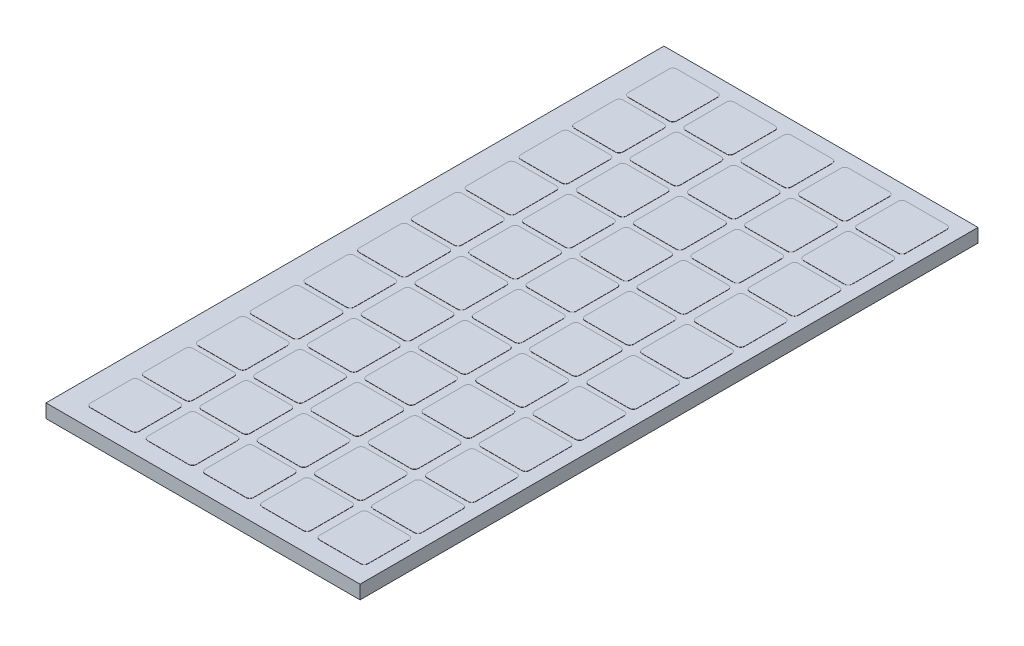
from build123d import *

# Parameters (mm, degrees)
SKETCH_5_W          = 806
SKETCH_5_H          = 1586
EXTRUDE_1_DEPTH     = 35
EXTRUDE_2_DEPTH     = 0.5
EXTRUDE_2_2_DEPTH   = 0.5
EXTRUDE_2_3_DEPTH   = 0.5
EXTRUDE_2_4_DEPTH   = 0.5
EXTRUDE_2_5_DEPTH   = 0.5
EXTRUDE_2_6_DEPTH   = 0.5
EXTRUDE_2_7_DEPTH   = 0.5
EXTRUDE_2_8_DEPTH   = 0.5
EXTRUDE_2_9_DEPTH   = 0.5
EXTRUDE_2_10_DEPTH  = 0.5
EXTRUDE_2_11_DEPTH  = 0.5
EXTRUDE_2_12_DEPTH  = 0.5
EXTRUDE_2_13_DEPTH  = 0.5
EXTRUDE_2_14_DEPTH  = 0.5
EXTRUDE_2_15_DEPTH  = 0.5
EXTRUDE_2_16_DEPTH  = 0.5
EXTRUDE_2_17_DEPTH  = 0.5
EXTRUDE_2_18_DEPTH  = 0.5
EXTRUDE_2_19_DEPTH  = 0.5
EXTRUDE_2_20_DEPTH  = 0.5
EXTRUDE_2_21_DEPTH  = 0.5
EXTRUDE_2_22_DEPTH  = 0.5
EXTRUDE_2_23_DEPTH  = 0.5
EXTRUDE_2_24_DEPTH  = 0.5
EXTRUDE_2_25_DEPTH  = 0.5
EXTRUDE_2_26_DEPTH  = 0.5
EXTRUDE_2_27_DEPTH  = 0.5
EXTRUDE_2_28_DEPTH  = 0.5
EXTRUDE_2_29_DEPTH  = 0.5
EXTRUDE_2_30_DEPTH  = 0.5
EXTRUDE_2_31_DEPTH  = 0.5
EXTRUDE_2_32_DEPTH  = 0.5
EXTRUDE_2_33_DEPTH  = 0.5
EXTRUDE_2_34_DEPTH  = 0.5
EXTRUDE_2_35_DEPTH  = 0.5
EXTRUDE_2_36_DEPTH  = 0.5
EXTRUDE_2_37_DEPTH  = 0.5
EXTRUDE_2_38_DEPTH  = 0.5
EXTRUDE_2_39_DEPTH  = 0.5
EXTRUDE_2_40_DEPTH  = 0.5
EXTRUDE_2_41_DEPTH  = 0.5
EXTRUDE_2_42_DEPTH  = 0.5
EXTRUDE_2_43_DEPTH  = 0.5
EXTRUDE_2_44_DEPTH  = 0.5
EXTRUDE_2_45_DEPTH  = 0.5
EXTRUDE_2_46_DEPTH  = 0.5
EXTRUDE_2_47_DEPTH  = 0.5
EXTRUDE_2_48_DEPTH  = 0.5
EXTRUDE_2_49_DEPTH  = 0.5
EXTRUDE_2_50_DEPTH  = 0.5
EXTRUDE_2_51_DEPTH  = 0.5
EXTRUDE_2_52_DEPTH  = 0.5
EXTRUDE_2_53_DEPTH  = 0.5
EXTRUDE_2_54_DEPTH  = 0.5
EXTRUDE_2_55_DEPTH  = 0.5
SKETCH_8_W          = 30
SKETCH_8_H          = 30
EXTRUDE_3_DEPTH     = 30
SKETCH_9_R          = 12.5
CUT_EXTRUDE_1_DEPTH = 1641.542669363


with BuildPart() as part:
    # Эскиз5 → Бобышка-Вытянуть1 (new body)
    with BuildSketch(Plane(origin=(0, 0, 0), x_dir=(1, 0, 0), z_dir=(0, 1, 0))):
        with Locations((403, 793)):
            Rectangle(SKETCH_5_W, SKETCH_5_H)
    extrude(amount=EXTRUDE_1_DEPTH)

    # Эскиз8 → Бобышка-Вытянуть3 (add)
    with BuildSketch(Plane.XZ):
        with Locations((403, -793)):
            Rectangle(SKETCH_8_W, SKETCH_8_H)
    extrude(amount=EXTRUDE_3_DEPTH)

    # Эскиз9 → Вырез-Вытянуть1 (cut, through all)
    with BuildSketch(Plane.ZY.offset(-388)):
        with Locations((-793, -15)):
            Circle(SKETCH_9_R)
    extrude(amount=-CUT_EXTRUDE_1_DEPTH, mode=Mode.SUBTRACT)


with BuildPart() as body_2:
    # Эскиз7 → Бобышка-Вытянуть2 (new body)
    with BuildSketch(Plane(origin=(0, 35, 0), x_dir=(1, 0, 0), z_dir=(0, 1, 0))):
        with BuildLine():
            Line((761, 1551), (656, 1551))
            ThreePointArc((656, 1551), (648.928932188, 1548.071067812), (646, 1541))
            Line((646, 1541), (646, 1436))
            ThreePointArc((646, 1436), (648.928932188, 1428.928932188), (656, 1426))
            Line((656, 1426), (761, 1426))
            ThreePointArc((761, 1426), (768.071067812, 1428.928932188), (771, 1436))
            Line((771, 1436), (771, 1541))
            ThreePointArc((771, 1541), (768.071067812, 1548.071067812), (761, 1551))
        make_face()
    extrude(amount=EXTRUDE_2_DEPTH)


with BuildPart() as body_3:
    # Эскиз7 → Extrude 2 2 (new body)
    with BuildSketch(Plane(origin=(0, 35, 0), x_dir=(1, 0, 0), z_dir=(0, 1, 0))):
        with BuildLine():
            Line((771, 1403), (771, 1298))
            ThreePointArc((771, 1298), (768.071067812, 1290.928932188), (761, 1288))
            Line((761, 1288), (656, 1288))
            ThreePointArc((656, 1288), (648.928932188, 1290.928932188), (646, 1298))
            Line((646, 1298), (646, 1403))
            ThreePointArc((646, 1403), (648.928932188, 1410.071067812), (656, 1413))
            Line((656, 1413), (761, 1413))
            ThreePointArc((761, 1413), (768.071067812, 1410.071067812), (771, 1403))
        make_face()
    extrude(amount=EXTRUDE_2_2_DEPTH)


with BuildPart() as body_4:
    # Эскиз7 → Extrude 2 3 (new body)
    with BuildSketch(Plane(origin=(0, 35, 0), x_dir=(1, 0, 0), z_dir=(0, 1, 0))):
        with BuildLine():
            Line((771, 1265), (771, 1160))
            ThreePointArc((771, 1160), (768.071067812, 1152.928932188), (761, 1150))
            Line((761, 1150), (656, 1150))
            ThreePointArc((656, 1150), (648.928932188, 1152.928932188), (646, 1160))
            Line((646, 1160), (646, 1265))
            ThreePointArc((646, 1265), (648.928932188, 1272.071067812), (656, 1275))
            Line((656, 1275), (761, 1275))
            ThreePointArc((761, 1275), (768.071067812, 1272.071067812), (771, 1265))
        make_face()
    extrude(amount=EXTRUDE_2_3_DEPTH)


with BuildPart() as body_5:
    # Эскиз7 → Extrude 2 4 (new body)
    with BuildSketch(Plane(origin=(0, 35, 0), x_dir=(1, 0, 0), z_dir=(0, 1, 0))):
        with BuildLine():
            Line((771, 1127), (771, 1022))
            ThreePointArc((771, 1022), (768.071067812, 1014.928932188), (761, 1012))
            Line((761, 1012), (656, 1012))
            ThreePointArc((656, 1012), (648.928932188, 1014.928932188), (646, 1022))
            Line((646, 1022), (646, 1127))
            ThreePointArc((646, 1127), (648.928932188, 1134.071067812), (656, 1137))
            Line((656, 1137), (761, 1137))
            ThreePointArc((761, 1137), (768.071067812, 1134.071067812), (771, 1127))
        make_face()
    extrude(amount=EXTRUDE_2_4_DEPTH)


with BuildPart() as body_6:
    # Эскиз7 → Extrude 2 5 (new body)
    with BuildSketch(Plane(origin=(0, 35, 0), x_dir=(1, 0, 0), z_dir=(0, 1, 0))):
        with BuildLine():
            Line((771, 989), (771, 884))
            ThreePointArc((771, 884), (768.071067812, 876.928932188), (761, 874))
            Line((761, 874), (656, 874))
            ThreePointArc((656, 874), (648.928932188, 876.928932188), (646, 884))
            Line((646, 884), (646, 989))
            ThreePointArc((646, 989), (648.928932188, 996.071067812), (656, 999))
            Line((656, 999), (761, 999))
            ThreePointArc((761, 999), (768.071067812, 996.071067812), (771, 989))
        make_face()
    extrude(amount=EXTRUDE_2_5_DEPTH)


with BuildPart() as body_7:
    # Эскиз7 → Extrude 2 6 (new body)
    with BuildSketch(Plane(origin=(0, 35, 0), x_dir=(1, 0, 0), z_dir=(0, 1, 0))):
        with BuildLine():
            Line((771, 851), (771, 746))
            ThreePointArc((771, 746), (768.071067812, 738.928932188), (761, 736))
            Line((761, 736), (656, 736))
            ThreePointArc((656, 736), (648.928932188, 738.928932188), (646, 746))
            Line((646, 746), (646, 851))
            ThreePointArc((646, 851), (648.928932188, 858.071067812), (656, 861))
            Line((656, 861), (761, 861))
            ThreePointArc((761, 861), (768.071067812, 858.071067812), (771, 851))
        make_face()
    extrude(amount=EXTRUDE_2_6_DEPTH)


with BuildPart() as body_8:
    # Эскиз7 → Extrude 2 7 (new body)
    with BuildSketch(Plane(origin=(0, 35, 0), x_dir=(1, 0, 0), z_dir=(0, 1, 0))):
        with BuildLine():
            Line((771, 713), (771, 608))
            ThreePointArc((771, 608), (768.071067812, 600.928932188), (761, 598))
            Line((761, 598), (656, 598))
            ThreePointArc((656, 598), (648.928932188, 600.928932188), (646, 608))
            Line((646, 608), (646, 713))
            ThreePointArc((646, 713), (648.928932188, 720.071067812), (656, 723))
            Line((656, 723), (761, 723))
            ThreePointArc((761, 723), (768.071067812, 720.071067812), (771, 713))
        make_face()
    extrude(amount=EXTRUDE_2_7_DEPTH)


with BuildPart() as body_9:
    # Эскиз7 → Extrude 2 8 (new body)
    with BuildSketch(Plane(origin=(0, 35, 0), x_dir=(1, 0, 0), z_dir=(0, 1, 0))):
        with BuildLine():
            Line((771, 575), (771, 470))
            ThreePointArc((771, 470), (768.071067812, 462.928932188), (761, 460))
            Line((761, 460), (656, 460))
            ThreePointArc((656, 460), (648.928932188, 462.928932188), (646, 470))
            Line((646, 470), (646, 575))
            ThreePointArc((646, 575), (648.928932188, 582.071067812), (656, 585))
            Line((656, 585), (761, 585))
            ThreePointArc((761, 585), (768.071067812, 582.071067812), (771, 575))
        make_face()
    extrude(amount=EXTRUDE_2_8_DEPTH)


with BuildPart() as body_10:
    # Эскиз7 → Extrude 2 9 (new body)
    with BuildSketch(Plane(origin=(0, 35, 0), x_dir=(1, 0, 0), z_dir=(0, 1, 0))):
        with BuildLine():
            Line((771, 437), (771, 332))
            ThreePointArc((771, 332), (768.071067812, 324.928932188), (761, 322))
            Line((761, 322), (656, 322))
            ThreePointArc((656, 322), (648.928932188, 324.928932188), (646, 332))
            Line((646, 332), (646, 437))
            ThreePointArc((646, 437), (648.928932188, 444.071067812), (656, 447))
            Line((656, 447), (761, 447))
            ThreePointArc((761, 447), (768.071067812, 444.071067812), (771, 437))
        make_face()
    extrude(amount=EXTRUDE_2_9_DEPTH)


with BuildPart() as body_11:
    # Эскиз7 → Extrude 2 10 (new body)
    with BuildSketch(Plane(origin=(0, 35, 0), x_dir=(1, 0, 0), z_dir=(0, 1, 0))):
        with BuildLine():
            Line((771, 299), (771, 194))
            ThreePointArc((771, 194), (768.071067812, 186.928932188), (761, 184))
            Line((761, 184), (656, 184))
            ThreePointArc((656, 184), (648.928932188, 186.928932188), (646, 194))
            Line((646, 194), (646, 299))
            ThreePointArc((646, 299), (648.928932188, 306.071067812), (656, 309))
            Line((656, 309), (761, 309))
            ThreePointArc((761, 309), (768.071067812, 306.071067812), (771, 299))
        make_face()
    extrude(amount=EXTRUDE_2_10_DEPTH)


with BuildPart() as body_12:
    # Эскиз7 → Extrude 2 11 (new body)
    with BuildSketch(Plane(origin=(0, 35, 0), x_dir=(1, 0, 0), z_dir=(0, 1, 0))):
        with BuildLine():
            Line((771, 161), (771, 56))
            ThreePointArc((771, 56), (768.071067812, 48.928932188), (761, 46))
            Line((761, 46), (656, 46))
            ThreePointArc((656, 46), (648.928932188, 48.928932188), (646, 56))
            Line((646, 56), (646, 161))
            ThreePointArc((646, 161), (648.928932188, 168.071067812), (656, 171))
            Line((656, 171), (761, 171))
            ThreePointArc((761, 171), (768.071067812, 168.071067812), (771, 161))
        make_face()
    extrude(amount=EXTRUDE_2_11_DEPTH)


with BuildPart() as body_13:
    # Эскиз7 → Extrude 2 12 (new body)
    with BuildSketch(Plane(origin=(0, 35, 0), x_dir=(1, 0, 0), z_dir=(0, 1, 0))):
        with BuildLine():
            Line((624, 1541), (624, 1436))
            ThreePointArc((624, 1436), (621.071067812, 1428.928932188), (614, 1426))
            Line((614, 1426), (509, 1426))
            ThreePointArc((509, 1426), (501.928932188, 1428.928932188), (499, 1436))
            Line((499, 1436), (499, 1541))
            ThreePointArc((499, 1541), (501.928932188, 1548.071067812), (509, 1551))
            Line((509, 1551), (614, 1551))
            ThreePointArc((614, 1551), (621.071067812, 1548.071067812), (624, 1541))
        make_face()
    extrude(amount=EXTRUDE_2_12_DEPTH)


with BuildPart() as body_14:
    # Эскиз7 → Extrude 2 13 (new body)
    with BuildSketch(Plane(origin=(0, 35, 0), x_dir=(1, 0, 0), z_dir=(0, 1, 0))):
        with BuildLine():
            Line((624, 1265), (624, 1160))
            ThreePointArc((624, 1160), (621.071067812, 1152.928932188), (614, 1150))
            Line((614, 1150), (509, 1150))
            ThreePointArc((509, 1150), (501.928932188, 1152.928932188), (499, 1160))
            Line((499, 1160), (499, 1265))
            ThreePointArc((499, 1265), (501.928932188, 1272.071067812), (509, 1275))
            Line((509, 1275), (614, 1275))
            ThreePointArc((614, 1275), (621.071067812, 1272.071067812), (624, 1265))
        make_face()
    extrude(amount=EXTRUDE_2_13_DEPTH)


with BuildPart() as body_15:
    # Эскиз7 → Extrude 2 14 (new body)
    with BuildSketch(Plane(origin=(0, 35, 0), x_dir=(1, 0, 0), z_dir=(0, 1, 0))):
        with BuildLine():
            Line((624, 1403), (624, 1298))
            ThreePointArc((624, 1298), (621.071067812, 1290.928932188), (614, 1288))
            Line((614, 1288), (509, 1288))
            ThreePointArc((509, 1288), (501.928932188, 1290.928932188), (499, 1298))
            Line((499, 1298), (499, 1403))
            ThreePointArc((499, 1403), (501.928932188, 1410.071067812), (509, 1413))
            Line((509, 1413), (614, 1413))
            ThreePointArc((614, 1413), (621.071067812, 1410.071067812), (624, 1403))
        make_face()
    extrude(amount=EXTRUDE_2_14_DEPTH)


with BuildPart() as body_16:
    # Эскиз7 → Extrude 2 15 (new body)
    with BuildSketch(Plane(origin=(0, 35, 0), x_dir=(1, 0, 0), z_dir=(0, 1, 0))):
        with BuildLine():
            Line((624, 989), (624, 884))
            ThreePointArc((624, 884), (621.071067812, 876.928932188), (614, 874))
            Line((614, 874), (509, 874))
            ThreePointArc((509, 874), (501.928932188, 876.928932188), (499, 884))
            Line((499, 884), (499, 989))
            ThreePointArc((499, 989), (501.928932188, 996.071067812), (509, 999))
            Line((509, 999), (614, 999))
            ThreePointArc((614, 999), (621.071067812, 996.071067812), (624, 989))
        make_face()
    extrude(amount=EXTRUDE_2_15_DEPTH)


with BuildPart() as body_17:
    # Эскиз7 → Extrude 2 16 (new body)
    with BuildSketch(Plane(origin=(0, 35, 0), x_dir=(1, 0, 0), z_dir=(0, 1, 0))):
        with BuildLine():
            Line((624, 1127), (624, 1022))
            ThreePointArc((624, 1022), (621.071067812, 1014.928932188), (614, 1012))
            Line((614, 1012), (509, 1012))
            ThreePointArc((509, 1012), (501.928932188, 1014.928932188), (499, 1022))
            Line((499, 1022), (499, 1127))
            ThreePointArc((499, 1127), (501.928932188, 1134.071067812), (509, 1137))
            Line((509, 1137), (614, 1137))
            ThreePointArc((614, 1137), (621.071067812, 1134.071067812), (624, 1127))
        make_face()
    extrude(amount=EXTRUDE_2_16_DEPTH)


with BuildPart() as body_18:
    # Эскиз7 → Extrude 2 17 (new body)
    with BuildSketch(Plane(origin=(0, 35, 0), x_dir=(1, 0, 0), z_dir=(0, 1, 0))):
        with BuildLine():
            Line((624, 851), (624, 746))
            ThreePointArc((624, 746), (621.071067812, 738.928932188), (614, 736))
            Line((614, 736), (509, 736))
            ThreePointArc((509, 736), (501.928932188, 738.928932188), (499, 746))
            Line((499, 746), (499, 851))
            ThreePointArc((499, 851), (501.928932188, 858.071067812), (509, 861))
            Line((509, 861), (614, 861))
            ThreePointArc((614, 861), (621.071067812, 858.071067812), (624, 851))
        make_face()
    extrude(amount=EXTRUDE_2_17_DEPTH)


with BuildPart() as body_19:
    # Эскиз7 → Extrude 2 18 (new body)
    with BuildSketch(Plane(origin=(0, 35, 0), x_dir=(1, 0, 0), z_dir=(0, 1, 0))):
        with BuildLine():
            Line((624, 713), (624, 608))
            ThreePointArc((624, 608), (621.071067812, 600.928932188), (614, 598))
            Line((614, 598), (509, 598))
            ThreePointArc((509, 598), (501.928932188, 600.928932188), (499, 608))
            Line((499, 608), (499, 713))
            ThreePointArc((499, 713), (501.928932188, 720.071067812), (509, 723))
            Line((509, 723), (614, 723))
            ThreePointArc((614, 723), (621.071067812, 720.071067812), (624, 713))
        make_face()
    extrude(amount=EXTRUDE_2_18_DEPTH)


with BuildPart() as body_20:
    # Эскиз7 → Extrude 2 19 (new body)
    with BuildSketch(Plane(origin=(0, 35, 0), x_dir=(1, 0, 0), z_dir=(0, 1, 0))):
        with BuildLine():
            Line((624, 575), (624, 470))
            ThreePointArc((624, 470), (621.071067812, 462.928932188), (614, 460))
            Line((614, 460), (509, 460))
            ThreePointArc((509, 460), (501.928932188, 462.928932188), (499, 470))
            Line((499, 470), (499, 575))
            ThreePointArc((499, 575), (501.928932188, 582.071067812), (509, 585))
            Line((509, 585), (614, 585))
            ThreePointArc((614, 585), (621.071067812, 582.071067812), (624, 575))
        make_face()
    extrude(amount=EXTRUDE_2_19_DEPTH)


with BuildPart() as body_21:
    # Эскиз7 → Extrude 2 20 (new body)
    with BuildSketch(Plane(origin=(0, 35, 0), x_dir=(1, 0, 0), z_dir=(0, 1, 0))):
        with BuildLine():
            Line((624, 437), (624, 332))
            ThreePointArc((624, 332), (621.071067812, 324.928932188), (614, 322))
            Line((614, 322), (509, 322))
            ThreePointArc((509, 322), (501.928932188, 324.928932188), (499, 332))
            Line((499, 332), (499, 437))
            ThreePointArc((499, 437), (501.928932188, 444.071067812), (509, 447))
            Line((509, 447), (614, 447))
            ThreePointArc((614, 447), (621.071067812, 444.071067812), (624, 437))
        make_face()
    extrude(amount=EXTRUDE_2_20_DEPTH)


with BuildPart() as body_22:
    # Эскиз7 → Extrude 2 21 (new body)
    with BuildSketch(Plane(origin=(0, 35, 0), x_dir=(1, 0, 0), z_dir=(0, 1, 0))):
        with BuildLine():
            Line((624, 299), (624, 194))
            ThreePointArc((624, 194), (621.071067812, 186.928932188), (614, 184))
            Line((614, 184), (509, 184))
            ThreePointArc((509, 184), (501.928932188, 186.928932188), (499, 194))
            Line((499, 194), (499, 299))
            ThreePointArc((499, 299), (501.928932188, 306.071067812), (509, 309))
            Line((509, 309), (614, 309))
            ThreePointArc((614, 309), (621.071067812, 306.071067812), (624, 299))
        make_face()
    extrude(amount=EXTRUDE_2_21_DEPTH)


with BuildPart() as body_23:
    # Эскиз7 → Extrude 2 22 (new body)
    with BuildSketch(Plane(origin=(0, 35, 0), x_dir=(1, 0, 0), z_dir=(0, 1, 0))):
        with BuildLine():
            Line((624, 161), (624, 56))
            ThreePointArc((624, 56), (621.071067812, 48.928932188), (614, 46))
            Line((614, 46), (509, 46))
            ThreePointArc((509, 46), (501.928932188, 48.928932188), (499, 56))
            Line((499, 56), (499, 161))
            ThreePointArc((499, 161), (501.928932188, 168.071067812), (509, 171))
            Line((509, 171), (614, 171))
            ThreePointArc((614, 171), (621.071067812, 168.071067812), (624, 161))
        make_face()
    extrude(amount=EXTRUDE_2_22_DEPTH)


with BuildPart() as body_24:
    # Эскиз7 → Extrude 2 23 (new body)
    with BuildSketch(Plane(origin=(0, 35, 0), x_dir=(1, 0, 0), z_dir=(0, 1, 0))):
        with BuildLine():
            Line((477, 1541), (477, 1436))
            ThreePointArc((477, 1436), (474.071067812, 1428.928932188), (467, 1426))
            Line((467, 1426), (362, 1426))
            ThreePointArc((362, 1426), (354.928932188, 1428.928932188), (352, 1436))
            Line((352, 1436), (352, 1541))
            ThreePointArc((352, 1541), (354.928932188, 1548.071067812), (362, 1551))
            Line((362, 1551), (467, 1551))
            ThreePointArc((467, 1551), (474.071067812, 1548.071067812), (477, 1541))
        make_face()
    extrude(amount=EXTRUDE_2_23_DEPTH)


with BuildPart() as body_25:
    # Эскиз7 → Extrude 2 24 (new body)
    with BuildSketch(Plane(origin=(0, 35, 0), x_dir=(1, 0, 0), z_dir=(0, 1, 0))):
        with BuildLine():
            Line((477, 1265), (477, 1160))
            ThreePointArc((477, 1160), (474.071067812, 1152.928932188), (467, 1150))
            Line((467, 1150), (362, 1150))
            ThreePointArc((362, 1150), (354.928932188, 1152.928932188), (352, 1160))
            Line((352, 1160), (352, 1265))
            ThreePointArc((352, 1265), (354.928932188, 1272.071067812), (362, 1275))
            Line((362, 1275), (467, 1275))
            ThreePointArc((467, 1275), (474.071067812, 1272.071067812), (477, 1265))
        make_face()
    extrude(amount=EXTRUDE_2_24_DEPTH)


with BuildPart() as body_26:
    # Эскиз7 → Extrude 2 25 (new body)
    with BuildSketch(Plane(origin=(0, 35, 0), x_dir=(1, 0, 0), z_dir=(0, 1, 0))):
        with BuildLine():
            Line((477, 1403), (477, 1298))
            ThreePointArc((477, 1298), (474.071067812, 1290.928932188), (467, 1288))
            Line((467, 1288), (362, 1288))
            ThreePointArc((362, 1288), (354.928932188, 1290.928932188), (352, 1298))
            Line((352, 1298), (352, 1403))
            ThreePointArc((352, 1403), (354.928932188, 1410.071067812), (362, 1413))
            Line((362, 1413), (467, 1413))
            ThreePointArc((467, 1413), (474.071067812, 1410.071067812), (477, 1403))
        make_face()
    extrude(amount=EXTRUDE_2_25_DEPTH)


with BuildPart() as body_27:
    # Эскиз7 → Extrude 2 26 (new body)
    with BuildSketch(Plane(origin=(0, 35, 0), x_dir=(1, 0, 0), z_dir=(0, 1, 0))):
        with BuildLine():
            Line((477, 989), (477, 884))
            ThreePointArc((477, 884), (474.071067812, 876.928932188), (467, 874))
            Line((467, 874), (362, 874))
            ThreePointArc((362, 874), (354.928932188, 876.928932188), (352, 884))
            Line((352, 884), (352, 989))
            ThreePointArc((352, 989), (354.928932188, 996.071067812), (362, 999))
            Line((362, 999), (467, 999))
            ThreePointArc((467, 999), (474.071067812, 996.071067812), (477, 989))
        make_face()
    extrude(amount=EXTRUDE_2_26_DEPTH)


with BuildPart() as body_28:
    # Эскиз7 → Extrude 2 27 (new body)
    with BuildSketch(Plane(origin=(0, 35, 0), x_dir=(1, 0, 0), z_dir=(0, 1, 0))):
        with BuildLine():
            Line((477, 1127), (477, 1022))
            ThreePointArc((477, 1022), (474.071067812, 1014.928932188), (467, 1012))
            Line((467, 1012), (362, 1012))
            ThreePointArc((362, 1012), (354.928932188, 1014.928932188), (352, 1022))
            Line((352, 1022), (352, 1127))
            ThreePointArc((352, 1127), (354.928932188, 1134.071067812), (362, 1137))
            Line((362, 1137), (467, 1137))
            ThreePointArc((467, 1137), (474.071067812, 1134.071067812), (477, 1127))
        make_face()
    extrude(amount=EXTRUDE_2_27_DEPTH)


with BuildPart() as body_29:
    # Эскиз7 → Extrude 2 28 (new body)
    with BuildSketch(Plane(origin=(0, 35, 0), x_dir=(1, 0, 0), z_dir=(0, 1, 0))):
        with BuildLine():
            Line((477, 851), (477, 746))
            ThreePointArc((477, 746), (474.071067812, 738.928932188), (467, 736))
            Line((467, 736), (362, 736))
            ThreePointArc((362, 736), (354.928932188, 738.928932188), (352, 746))
            Line((352, 746), (352, 851))
            ThreePointArc((352, 851), (354.928932188, 858.071067812), (362, 861))
            Line((362, 861), (467, 861))
            ThreePointArc((467, 861), (474.071067812, 858.071067812), (477, 851))
        make_face()
    extrude(amount=EXTRUDE_2_28_DEPTH)


with BuildPart() as body_30:
    # Эскиз7 → Extrude 2 29 (new body)
    with BuildSketch(Plane(origin=(0, 35, 0), x_dir=(1, 0, 0), z_dir=(0, 1, 0))):
        with BuildLine():
            Line((477, 713), (477, 608))
            ThreePointArc((477, 608), (474.071067812, 600.928932188), (467, 598))
            Line((467, 598), (362, 598))
            ThreePointArc((362, 598), (354.928932188, 600.928932188), (352, 608))
            Line((352, 608), (352, 713))
            ThreePointArc((352, 713), (354.928932188, 720.071067812), (362, 723))
            Line((362, 723), (467, 723))
            ThreePointArc((467, 723), (474.071067812, 720.071067812), (477, 713))
        make_face()
    extrude(amount=EXTRUDE_2_29_DEPTH)


with BuildPart() as body_31:
    # Эскиз7 → Extrude 2 30 (new body)
    with BuildSketch(Plane(origin=(0, 35, 0), x_dir=(1, 0, 0), z_dir=(0, 1, 0))):
        with BuildLine():
            Line((477, 575), (477, 470))
            ThreePointArc((477, 470), (474.071067812, 462.928932188), (467, 460))
            Line((467, 460), (362, 460))
            ThreePointArc((362, 460), (354.928932188, 462.928932188), (352, 470))
            Line((352, 470), (352, 575))
            ThreePointArc((352, 575), (354.928932188, 582.071067812), (362, 585))
            Line((362, 585), (467, 585))
            ThreePointArc((467, 585), (474.071067812, 582.071067812), (477, 575))
        make_face()
    extrude(amount=EXTRUDE_2_30_DEPTH)


with BuildPart() as body_32:
    # Эскиз7 → Extrude 2 31 (new body)
    with BuildSketch(Plane(origin=(0, 35, 0), x_dir=(1, 0, 0), z_dir=(0, 1, 0))):
        with BuildLine():
            Line((477, 437), (477, 332))
            ThreePointArc((477, 332), (474.071067812, 324.928932188), (467, 322))
            Line((467, 322), (362, 322))
            ThreePointArc((362, 322), (354.928932188, 324.928932188), (352, 332))
            Line((352, 332), (352, 437))
            ThreePointArc((352, 437), (354.928932188, 444.071067812), (362, 447))
            Line((362, 447), (467, 447))
            ThreePointArc((467, 447), (474.071067812, 444.071067812), (477, 437))
        make_face()
    extrude(amount=EXTRUDE_2_31_DEPTH)


with BuildPart() as body_33:
    # Эскиз7 → Extrude 2 32 (new body)
    with BuildSketch(Plane(origin=(0, 35, 0), x_dir=(1, 0, 0), z_dir=(0, 1, 0))):
        with BuildLine():
            Line((477, 299), (477, 194))
            ThreePointArc((477, 194), (474.071067812, 186.928932188), (467, 184))
            Line((467, 184), (362, 184))
            ThreePointArc((362, 184), (354.928932188, 186.928932188), (352, 194))
            Line((352, 194), (352, 299))
            ThreePointArc((352, 299), (354.928932188, 306.071067812), (362, 309))
            Line((362, 309), (467, 309))
            ThreePointArc((467, 309), (474.071067812, 306.071067812), (477, 299))
        make_face()
    extrude(amount=EXTRUDE_2_32_DEPTH)


with BuildPart() as body_34:
    # Эскиз7 → Extrude 2 33 (new body)
    with BuildSketch(Plane(origin=(0, 35, 0), x_dir=(1, 0, 0), z_dir=(0, 1, 0))):
        with BuildLine():
            Line((477, 161), (477, 56))
            ThreePointArc((477, 56), (474.071067812, 48.928932188), (467, 46))
            Line((467, 46), (362, 46))
            ThreePointArc((362, 46), (354.928932188, 48.928932188), (352, 56))
            Line((352, 56), (352, 161))
            ThreePointArc((352, 161), (354.928932188, 168.071067812), (362, 171))
            Line((362, 171), (467, 171))
            ThreePointArc((467, 171), (474.071067812, 168.071067812), (477, 161))
        make_face()
    extrude(amount=EXTRUDE_2_33_DEPTH)


with BuildPart() as body_35:
    # Эскиз7 → Extrude 2 34 (new body)
    with BuildSketch(Plane(origin=(0, 35, 0), x_dir=(1, 0, 0), z_dir=(0, 1, 0))):
        with BuildLine():
            Line((330, 1541), (330, 1436))
            ThreePointArc((330, 1436), (327.071067812, 1428.928932188), (320, 1426))
            Line((320, 1426), (215, 1426))
            ThreePointArc((215, 1426), (207.928932188, 1428.928932188), (205, 1436))
            Line((205, 1436), (205, 1541))
            ThreePointArc((205, 1541), (207.928932188, 1548.071067812), (215, 1551))
            Line((215, 1551), (320, 1551))
            ThreePointArc((320, 1551), (327.071067812, 1548.071067812), (330, 1541))
        make_face()
    extrude(amount=EXTRUDE_2_34_DEPTH)


with BuildPart() as body_36:
    # Эскиз7 → Extrude 2 35 (new body)
    with BuildSketch(Plane(origin=(0, 35, 0), x_dir=(1, 0, 0), z_dir=(0, 1, 0))):
        with BuildLine():
            Line((330, 1265), (330, 1160))
            ThreePointArc((330, 1160), (327.071067812, 1152.928932188), (320, 1150))
            Line((320, 1150), (215, 1150))
            ThreePointArc((215, 1150), (207.928932188, 1152.928932188), (205, 1160))
            Line((205, 1160), (205, 1265))
            ThreePointArc((205, 1265), (207.928932188, 1272.071067812), (215, 1275))
            Line((215, 1275), (320, 1275))
            ThreePointArc((320, 1275), (327.071067812, 1272.071067812), (330, 1265))
        make_face()
    extrude(amount=EXTRUDE_2_35_DEPTH)


with BuildPart() as body_37:
    # Эскиз7 → Extrude 2 36 (new body)
    with BuildSketch(Plane(origin=(0, 35, 0), x_dir=(1, 0, 0), z_dir=(0, 1, 0))):
        with BuildLine():
            Line((330, 1403), (330, 1298))
            ThreePointArc((330, 1298), (327.071067812, 1290.928932188), (320, 1288))
            Line((320, 1288), (215, 1288))
            ThreePointArc((215, 1288), (207.928932188, 1290.928932188), (205, 1298))
            Line((205, 1298), (205, 1403))
            ThreePointArc((205, 1403), (207.928932188, 1410.071067812), (215, 1413))
            Line((215, 1413), (320, 1413))
            ThreePointArc((320, 1413), (327.071067812, 1410.071067812), (330, 1403))
        make_face()
    extrude(amount=EXTRUDE_2_36_DEPTH)


with BuildPart() as body_38:
    # Эскиз7 → Extrude 2 37 (new body)
    with BuildSketch(Plane(origin=(0, 35, 0), x_dir=(1, 0, 0), z_dir=(0, 1, 0))):
        with BuildLine():
            Line((330, 989), (330, 884))
            ThreePointArc((330, 884), (327.071067812, 876.928932188), (320, 874))
            Line((320, 874), (215, 874))
            ThreePointArc((215, 874), (207.928932188, 876.928932188), (205, 884))
            Line((205, 884), (205, 989))
            ThreePointArc((205, 989), (207.928932188, 996.071067812), (215, 999))
            Line((215, 999), (320, 999))
            ThreePointArc((320, 999), (327.071067812, 996.071067812), (330, 989))
        make_face()
    extrude(amount=EXTRUDE_2_37_DEPTH)


with BuildPart() as body_39:
    # Эскиз7 → Extrude 2 38 (new body)
    with BuildSketch(Plane(origin=(0, 35, 0), x_dir=(1, 0, 0), z_dir=(0, 1, 0))):
        with BuildLine():
            Line((330, 1127), (330, 1022))
            ThreePointArc((330, 1022), (327.071067812, 1014.928932188), (320, 1012))
            Line((320, 1012), (215, 1012))
            ThreePointArc((215, 1012), (207.928932188, 1014.928932188), (205, 1022))
            Line((205, 1022), (205, 1127))
            ThreePointArc((205, 1127), (207.928932188, 1134.071067812), (215, 1137))
            Line((215, 1137), (320, 1137))
            ThreePointArc((320, 1137), (327.071067812, 1134.071067812), (330, 1127))
        make_face()
    extrude(amount=EXTRUDE_2_38_DEPTH)


with BuildPart() as body_40:
    # Эскиз7 → Extrude 2 39 (new body)
    with BuildSketch(Plane(origin=(0, 35, 0), x_dir=(1, 0, 0), z_dir=(0, 1, 0))):
        with BuildLine():
            Line((330, 851), (330, 746))
            ThreePointArc((330, 746), (327.071067812, 738.928932188), (320, 736))
            Line((320, 736), (215, 736))
            ThreePointArc((215, 736), (207.928932188, 738.928932188), (205, 746))
            Line((205, 746), (205, 851))
            ThreePointArc((205, 851), (207.928932188, 858.071067812), (215, 861))
            Line((215, 861), (320, 861))
            ThreePointArc((320, 861), (327.071067812, 858.071067812), (330, 851))
        make_face()
    extrude(amount=EXTRUDE_2_39_DEPTH)


with BuildPart() as body_41:
    # Эскиз7 → Extrude 2 40 (new body)
    with BuildSketch(Plane(origin=(0, 35, 0), x_dir=(1, 0, 0), z_dir=(0, 1, 0))):
        with BuildLine():
            Line((330, 713), (330, 608))
            ThreePointArc((330, 608), (327.071067812, 600.928932188), (320, 598))
            Line((320, 598), (215, 598))
            ThreePointArc((215, 598), (207.928932188, 600.928932188), (205, 608))
            Line((205, 608), (205, 713))
            ThreePointArc((205, 713), (207.928932188, 720.071067812), (215, 723))
            Line((215, 723), (320, 723))
            ThreePointArc((320, 723), (327.071067812, 720.071067812), (330, 713))
        make_face()
    extrude(amount=EXTRUDE_2_40_DEPTH)


with BuildPart() as body_42:
    # Эскиз7 → Extrude 2 41 (new body)
    with BuildSketch(Plane(origin=(0, 35, 0), x_dir=(1, 0, 0), z_dir=(0, 1, 0))):
        with BuildLine():
            Line((330, 575), (330, 470))
            ThreePointArc((330, 470), (327.071067812, 462.928932188), (320, 460))
            Line((320, 460), (215, 460))
            ThreePointArc((215, 460), (207.928932188, 462.928932188), (205, 470))
            Line((205, 470), (205, 575))
            ThreePointArc((205, 575), (207.928932188, 582.071067812), (215, 585))
            Line((215, 585), (320, 585))
            ThreePointArc((320, 585), (327.071067812, 582.071067812), (330, 575))
        make_face()
    extrude(amount=EXTRUDE_2_41_DEPTH)


with BuildPart() as body_43:
    # Эскиз7 → Extrude 2 42 (new body)
    with BuildSketch(Plane(origin=(0, 35, 0), x_dir=(1, 0, 0), z_dir=(0, 1, 0))):
        with BuildLine():
            Line((330, 437), (330, 332))
            ThreePointArc((330, 332), (327.071067812, 324.928932188), (320, 322))
            Line((320, 322), (215, 322))
            ThreePointArc((215, 322), (207.928932188, 324.928932188), (205, 332))
            Line((205, 332), (205, 437))
            ThreePointArc((205, 437), (207.928932188, 444.071067812), (215, 447))
            Line((215, 447), (320, 447))
            ThreePointArc((320, 447), (327.071067812, 444.071067812), (330, 437))
        make_face()
    extrude(amount=EXTRUDE_2_42_DEPTH)


with BuildPart() as body_44:
    # Эскиз7 → Extrude 2 43 (new body)
    with BuildSketch(Plane(origin=(0, 35, 0), x_dir=(1, 0, 0), z_dir=(0, 1, 0))):
        with BuildLine():
            Line((330, 299), (330, 194))
            ThreePointArc((330, 194), (327.071067812, 186.928932188), (320, 184))
            Line((320, 184), (215, 184))
            ThreePointArc((215, 184), (207.928932188, 186.928932188), (205, 194))
            Line((205, 194), (205, 299))
            ThreePointArc((205, 299), (207.928932188, 306.071067812), (215, 309))
            Line((215, 309), (320, 309))
            ThreePointArc((320, 309), (327.071067812, 306.071067812), (330, 299))
        make_face()
    extrude(amount=EXTRUDE_2_43_DEPTH)


with BuildPart() as body_45:
    # Эскиз7 → Extrude 2 44 (new body)
    with BuildSketch(Plane(origin=(0, 35, 0), x_dir=(1, 0, 0), z_dir=(0, 1, 0))):
        with BuildLine():
            Line((330, 161), (330, 56))
            ThreePointArc((330, 56), (327.071067812, 48.928932188), (320, 46))
            Line((320, 46), (215, 46))
            ThreePointArc((215, 46), (207.928932188, 48.928932188), (205, 56))
            Line((205, 56), (205, 161))
            ThreePointArc((205, 161), (207.928932188, 168.071067812), (215, 171))
            Line((215, 171), (320, 171))
            ThreePointArc((320, 171), (327.071067812, 168.071067812), (330, 161))
        make_face()
    extrude(amount=EXTRUDE_2_44_DEPTH)


with BuildPart() as body_46:
    # Эскиз7 → Extrude 2 45 (new body)
    with BuildSketch(Plane(origin=(0, 35, 0), x_dir=(1, 0, 0), z_dir=(0, 1, 0))):
        with BuildLine():
            Line((183, 1541), (183, 1436))
            ThreePointArc((183, 1436), (180.071067812, 1428.928932188), (173, 1426))
            Line((173, 1426), (68, 1426))
            ThreePointArc((68, 1426), (60.928932188, 1428.928932188), (58, 1436))
            Line((58, 1436), (58, 1541))
            ThreePointArc((58, 1541), (60.928932188, 1548.071067812), (68, 1551))
            Line((68, 1551), (173, 1551))
            ThreePointArc((173, 1551), (180.071067812, 1548.071067812), (183, 1541))
        make_face()
    extrude(amount=EXTRUDE_2_45_DEPTH)


with BuildPart() as body_47:
    # Эскиз7 → Extrude 2 46 (new body)
    with BuildSketch(Plane(origin=(0, 35, 0), x_dir=(1, 0, 0), z_dir=(0, 1, 0))):
        with BuildLine():
            Line((183, 1265), (183, 1160))
            ThreePointArc((183, 1160), (180.071067812, 1152.928932188), (173, 1150))
            Line((173, 1150), (68, 1150))
            ThreePointArc((68, 1150), (60.928932188, 1152.928932188), (58, 1160))
            Line((58, 1160), (58, 1265))
            ThreePointArc((58, 1265), (60.928932188, 1272.071067812), (68, 1275))
            Line((68, 1275), (173, 1275))
            ThreePointArc((173, 1275), (180.071067812, 1272.071067812), (183, 1265))
        make_face()
    extrude(amount=EXTRUDE_2_46_DEPTH)


with BuildPart() as body_48:
    # Эскиз7 → Extrude 2 47 (new body)
    with BuildSketch(Plane(origin=(0, 35, 0), x_dir=(1, 0, 0), z_dir=(0, 1, 0))):
        with BuildLine():
            Line((183, 1403), (183, 1298))
            ThreePointArc((183, 1298), (180.071067812, 1290.928932188), (173, 1288))
            Line((173, 1288), (68, 1288))
            ThreePointArc((68, 1288), (60.928932188, 1290.928932188), (58, 1298))
            Line((58, 1298), (58, 1403))
            ThreePointArc((58, 1403), (60.928932188, 1410.071067812), (68, 1413))
            Line((68, 1413), (173, 1413))
            ThreePointArc((173, 1413), (180.071067812, 1410.071067812), (183, 1403))
        make_face()
    extrude(amount=EXTRUDE_2_47_DEPTH)


with BuildPart() as body_49:
    # Эскиз7 → Extrude 2 48 (new body)
    with BuildSketch(Plane(origin=(0, 35, 0), x_dir=(1, 0, 0), z_dir=(0, 1, 0))):
        with BuildLine():
            Line((183, 989), (183, 884))
            ThreePointArc((183, 884), (180.071067812, 876.928932188), (173, 874))
            Line((173, 874), (68, 874))
            ThreePointArc((68, 874), (60.928932188, 876.928932188), (58, 884))
            Line((58, 884), (58, 989))
            ThreePointArc((58, 989), (60.928932188, 996.071067812), (68, 999))
            Line((68, 999), (173, 999))
            ThreePointArc((173, 999), (180.071067812, 996.071067812), (183, 989))
        make_face()
    extrude(amount=EXTRUDE_2_48_DEPTH)


with BuildPart() as body_50:
    # Эскиз7 → Extrude 2 49 (new body)
    with BuildSketch(Plane(origin=(0, 35, 0), x_dir=(1, 0, 0), z_dir=(0, 1, 0))):
        with BuildLine():
            Line((183, 1127), (183, 1022))
            ThreePointArc((183, 1022), (180.071067812, 1014.928932188), (173, 1012))
            Line((173, 1012), (68, 1012))
            ThreePointArc((68, 1012), (60.928932188, 1014.928932188), (58, 1022))
            Line((58, 1022), (58, 1127))
            ThreePointArc((58, 1127), (60.928932188, 1134.071067812), (68, 1137))
            Line((68, 1137), (173, 1137))
            ThreePointArc((173, 1137), (180.071067812, 1134.071067812), (183, 1127))
        make_face()
    extrude(amount=EXTRUDE_2_49_DEPTH)


with BuildPart() as body_51:
    # Эскиз7 → Extrude 2 50 (new body)
    with BuildSketch(Plane(origin=(0, 35, 0), x_dir=(1, 0, 0), z_dir=(0, 1, 0))):
        with BuildLine():
            Line((183, 851), (183, 746))
            ThreePointArc((183, 746), (180.071067812, 738.928932188), (173, 736))
            Line((173, 736), (68, 736))
            ThreePointArc((68, 736), (60.928932188, 738.928932188), (58, 746))
            Line((58, 746), (58, 851))
            ThreePointArc((58, 851), (60.928932188, 858.071067812), (68, 861))
            Line((68, 861), (173, 861))
            ThreePointArc((173, 861), (180.071067812, 858.071067812), (183, 851))
        make_face()
    extrude(amount=EXTRUDE_2_50_DEPTH)


with BuildPart() as body_52:
    # Эскиз7 → Extrude 2 51 (new body)
    with BuildSketch(Plane(origin=(0, 35, 0), x_dir=(1, 0, 0), z_dir=(0, 1, 0))):
        with BuildLine():
            Line((183, 713), (183, 608))
            ThreePointArc((183, 608), (180.071067812, 600.928932188), (173, 598))
            Line((173, 598), (68, 598))
            ThreePointArc((68, 598), (60.928932188, 600.928932188), (58, 608))
            Line((58, 608), (58, 713))
            ThreePointArc((58, 713), (60.928932188, 720.071067812), (68, 723))
            Line((68, 723), (173, 723))
            ThreePointArc((173, 723), (180.071067812, 720.071067812), (183, 713))
        make_face()
    extrude(amount=EXTRUDE_2_51_DEPTH)


with BuildPart() as body_53:
    # Эскиз7 → Extrude 2 52 (new body)
    with BuildSketch(Plane(origin=(0, 35, 0), x_dir=(1, 0, 0), z_dir=(0, 1, 0))):
        with BuildLine():
            Line((183, 575), (183, 470))
            ThreePointArc((183, 470), (180.071067812, 462.928932188), (173, 460))
            Line((173, 460), (68, 460))
            ThreePointArc((68, 460), (60.928932188, 462.928932188), (58, 470))
            Line((58, 470), (58, 575))
            ThreePointArc((58, 575), (60.928932188, 582.071067812), (68, 585))
            Line((68, 585), (173, 585))
            ThreePointArc((173, 585), (180.071067812, 582.071067812), (183, 575))
        make_face()
    extrude(amount=EXTRUDE_2_52_DEPTH)


with BuildPart() as body_54:
    # Эскиз7 → Extrude 2 53 (new body)
    with BuildSketch(Plane(origin=(0, 35, 0), x_dir=(1, 0, 0), z_dir=(0, 1, 0))):
        with BuildLine():
            Line((183, 437), (183, 332))
            ThreePointArc((183, 332), (180.071067812, 324.928932188), (173, 322))
            Line((173, 322), (68, 322))
            ThreePointArc((68, 322), (60.928932188, 324.928932188), (58, 332))
            Line((58, 332), (58, 437))
            ThreePointArc((58, 437), (60.928932188, 444.071067812), (68, 447))
            Line((68, 447), (173, 447))
            ThreePointArc((173, 447), (180.071067812, 444.071067812), (183, 437))
        make_face()
    extrude(amount=EXTRUDE_2_53_DEPTH)


with BuildPart() as body_55:
    # Эскиз7 → Extrude 2 54 (new body)
    with BuildSketch(Plane(origin=(0, 35, 0), x_dir=(1, 0, 0), z_dir=(0, 1, 0))):
        with BuildLine():
            Line((183, 299), (183, 194))
            ThreePointArc((183, 194), (180.071067812, 186.928932188), (173, 184))
            Line((173, 184), (68, 184))
            ThreePointArc((68, 184), (60.928932188, 186.928932188), (58, 194))
            Line((58, 194), (58, 299))
            ThreePointArc((58, 299), (60.928932188, 306.071067812), (68, 309))
            Line((68, 309), (173, 309))
            ThreePointArc((173, 309), (180.071067812, 306.071067812), (183, 299))
        make_face()
    extrude(amount=EXTRUDE_2_54_DEPTH)


with BuildPart() as body_56:
    # Эскиз7 → Extrude 2 55 (new body)
    with BuildSketch(Plane(origin=(0, 35, 0), x_dir=(1, 0, 0), z_dir=(0, 1, 0))):
        with BuildLine():
            Line((183, 161), (183, 56))
            ThreePointArc((183, 56), (180.071067812, 48.928932188), (173, 46))
            Line((173, 46), (68, 46))
            ThreePointArc((68, 46), (60.928932188, 48.928932188), (58, 56))
            Line((58, 56), (58, 161))
            ThreePointArc((58, 161), (60.928932188, 168.071067812), (68, 171))
            Line((68, 171), (173, 171))
            ThreePointArc((173, 171), (180.071067812, 168.071067812), (183, 161))
        make_face()
    extrude(amount=EXTRUDE_2_55_DEPTH)


solid = Compound([part.part, body_2.part, body_3.part, body_4.part, body_5.part, body_6.part, body_7.part, body_8.part, body_9.part, body_10.part, body_11.part, body_12.part, body_13.part, body_14.part, body_15.part, body_16.part, body_17.part, body_18.part, body_19.part, body_20.part, body_21.part, body_22.part, body_23.part, body_24.part, body_25.part, body_26.part, body_27.part, body_28.part, body_29.part, body_30.part, body_31.part, body_32.part, body_33.part, body_34.part, body_35.part, body_36.part, body_37.part, body_38.part, body_39.part, body_40.part, body_41.part, body_42.part, body_43.part, body_44.part, body_45.part, body_46.part, body_47.part, body_48.part, body_49.part, body_50.part, body_51.part, body_52.part, body_53.part, body_54.part, body_55.part, body_56.part])
